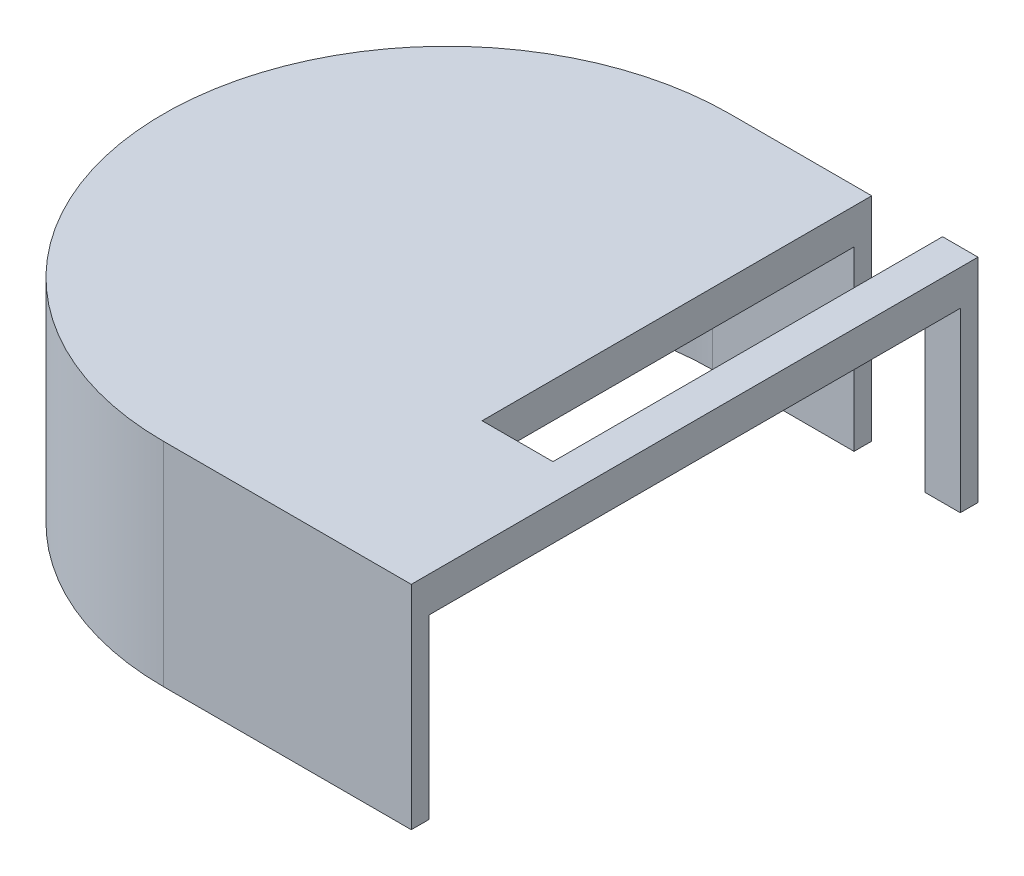
from build123d import *
from build123d.topology import SkipClean

# Parameters (mm, degrees)
BOSS_EXTRUDE1_DEPTH = 1
BOSS_EXTRUDE3_START = 5
BOSS_EXTRUDE3_DEPTH = 5
SKETCH6_W           = 2
SKETCH6_H           = 11
CUT_EXTRUDE1_DEPTH  = 7
SKETCH7_R           = 1.5
BOSS_EXTRUDE4_DEPTH = 1


with BuildPart() as part:
    # Sketch1 → Boss-Extrude1 (new body)
    with BuildSketch(Plane(origin=(0, 0, 0), x_dir=(1, 0, 0), z_dir=(0, 1, 0))):
        with BuildLine():
            Line((0, 8), (7.000000828, 8))
            Line((7.000000828, 8), (7.000000828, -8))
            Line((7.000000828, -8), (8.28e-07, -8))
            ThreePointArc((8.28e-07, -8), (-8, -4.14e-07), (0, 8))
        make_face()
    extrude(amount=BOSS_EXTRUDE1_DEPTH)

    # Sketch5 → Boss-Extrude3 (add)
    with SkipClean():  # the faces are left unmerged after this step: merging them gives an invalid solid
        with BuildSketch(Plane.XZ.offset(BOSS_EXTRUDE3_START)):
            with BuildLine():
                Line((0, 8), (7, 8))
                Line((7, 8), (7, 7.5))
                Line((7, 7.5), (0, 7.5))
                ThreePointArc((0, 7.5), (-7.5, 0), (0, -7.5))
                Line((0, -7.5), (7, -7.5))
                Line((7, -7.5), (7, -8))
                Line((7, -8), (0, -8))
                ThreePointArc((0, -8), (-8, 0), (0, 8))
            make_face()
        extrude(amount=-BOSS_EXTRUDE3_DEPTH)

    # Sketch6 → Cut-Extrude1 (cut)
    with SkipClean():  # the faces are left unmerged after this step: merging them gives an invalid solid
        with BuildSketch(Plane(origin=(0, 1, 0), x_dir=(1, 0, 0), z_dir=(0, 1, 0))):
            with Locations((5.000000828, 2.5)):
                Rectangle(SKETCH6_W, SKETCH6_H)
        extrude(amount=-CUT_EXTRUDE1_DEPTH, mode=Mode.SUBTRACT)

    # Sketch7 → Boss-Extrude4 (add)
    with SkipClean():  # the faces are left unmerged after this step: merging them gives an invalid solid
        with BuildSketch(Plane(origin=(0, 0, 7.5), x_dir=(-1, 0, 0), z_dir=(0, 0, -1))):
            with Locations(Location((-4.067547003, -3.5, 0), (0, 0, 270))):
                Circle(SKETCH7_R)
        extrude(amount=BOSS_EXTRUDE4_DEPTH)


solid = part.part
